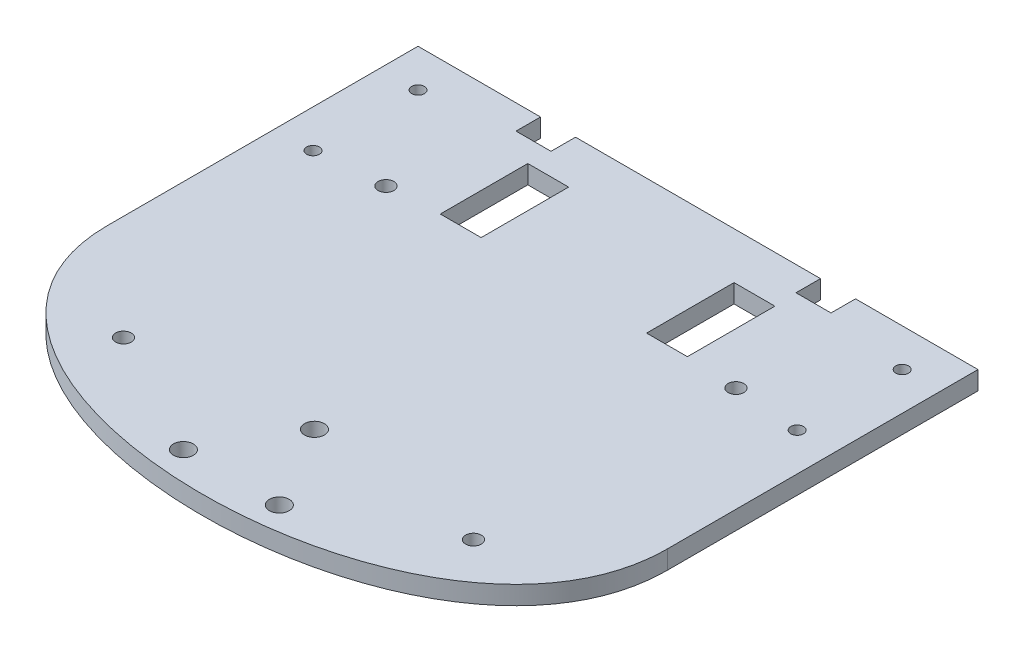
from build123d import *

# Parameters (mm, degrees)
BOSS_EXTRUDE1_DEPTH     = 3.175
CUT_EXTRUDE1_DEPTH      = 65.189801711
CUT_EXTRUDE1_DEPTH_BACK = 65.189801711
SKETCH3_R               = 1.0922
SKETCH3_R_2             = 1.35
SKETCH3_R_3             = 1.7
SKETCH3_W               = 7
SKETCH3_H               = 15
SKETCH5_W               = 6
SKETCH5_H               = 4.2
CUT_EXTRUDE2_DEPTH      = 65.189801711


with BuildPart() as part:
    # Sketch2 → Boss-Extrude1 (new body)
    with BuildSketch(Plane(origin=(0, 0, 0), x_dir=(1, 0, 0), z_dir=(0, 1, 0))):
        with BuildLine():
            Line((48, 42.5), (-48, 42.5))
            Line((-48, 42.5), (-48, -10.75))
            add(Edge.make_bspline(
                [(-48, -10.75), (-48, -53.083333333), (48, -53.083333333), (48, -10.75)],
                knots=[0, 0, 0, 0, 1, 1, 1, 1], degree=3))
            Line((48, -10.75), (48, 42.5))
        make_face()
    extrude(amount=BOSS_EXTRUDE1_DEPTH)

    # Sketch3 → Cut-Extrude1 (cut, two sides: drawn at the far end of the back side and taken through both)
    with BuildSketch(Plane(origin=(0, 3.175, 0), x_dir=(1, 0, 0), z_dir=(0, 1, 0)).offset(-CUT_EXTRUDE1_DEPTH_BACK)):
        with Locations(Location((-41.5, 36, 0), (0, 0, 270))):
            Circle(SKETCH3_R)
        with Locations(Location((-41.5, 18, 0), (0, 0, 270))):
            Circle(SKETCH3_R)
        with Locations(Location((-30, 19, 0), (0, 0, 270))):
            Circle(SKETCH3_R_2)
        with Locations(Location((41.5, 18, 0), (0, 0, 90))):
            Circle(SKETCH3_R)
        with Locations(Location((41.5, 36, 0), (0, 0, 90))):
            Circle(SKETCH3_R)
        with Locations(Location((-30, -26, 0), (0, 0, 270))):
            Circle(SKETCH3_R_2)
        with Locations(Location((30, -26, 0), (0, 0, 90))):
            Circle(SKETCH3_R_2)
        with Locations(Location((30, 19, 0), (0, 0, 90))):
            Circle(SKETCH3_R_2)
        with Locations(Location((-8.225, -37.5, 0), (0, 0, 270))):
            Circle(SKETCH3_R_3)
        with Locations(Location((8.225, -37.5, 0), (0, 0, 90))):
            Circle(SKETCH3_R_3)
        with Locations(Location((0, -23.253882108, 0), (0, 0, 90))):
            Circle(SKETCH3_R_3)
        with Locations((-17.68, 27)):
            Rectangle(SKETCH3_W, SKETCH3_H)
        with Locations((17.68, 27)):
            Rectangle(SKETCH3_W, SKETCH3_H)
    extrude(amount=CUT_EXTRUDE1_DEPTH + CUT_EXTRUDE1_DEPTH_BACK, mode=Mode.SUBTRACT)

    # Sketch5 → Cut-Extrude2 (cut, through all)
    with BuildSketch(Plane(origin=(0, 3.175, 0), x_dir=(1, 0, 0), z_dir=(0, 1, 0))):
        with Locations((24, 40.4)):
            Rectangle(SKETCH5_W, SKETCH5_H)
        with Locations((-24, 40.4)):
            Rectangle(SKETCH5_W, SKETCH5_H)
    extrude(amount=-CUT_EXTRUDE2_DEPTH, mode=Mode.SUBTRACT)


solid = part.part
